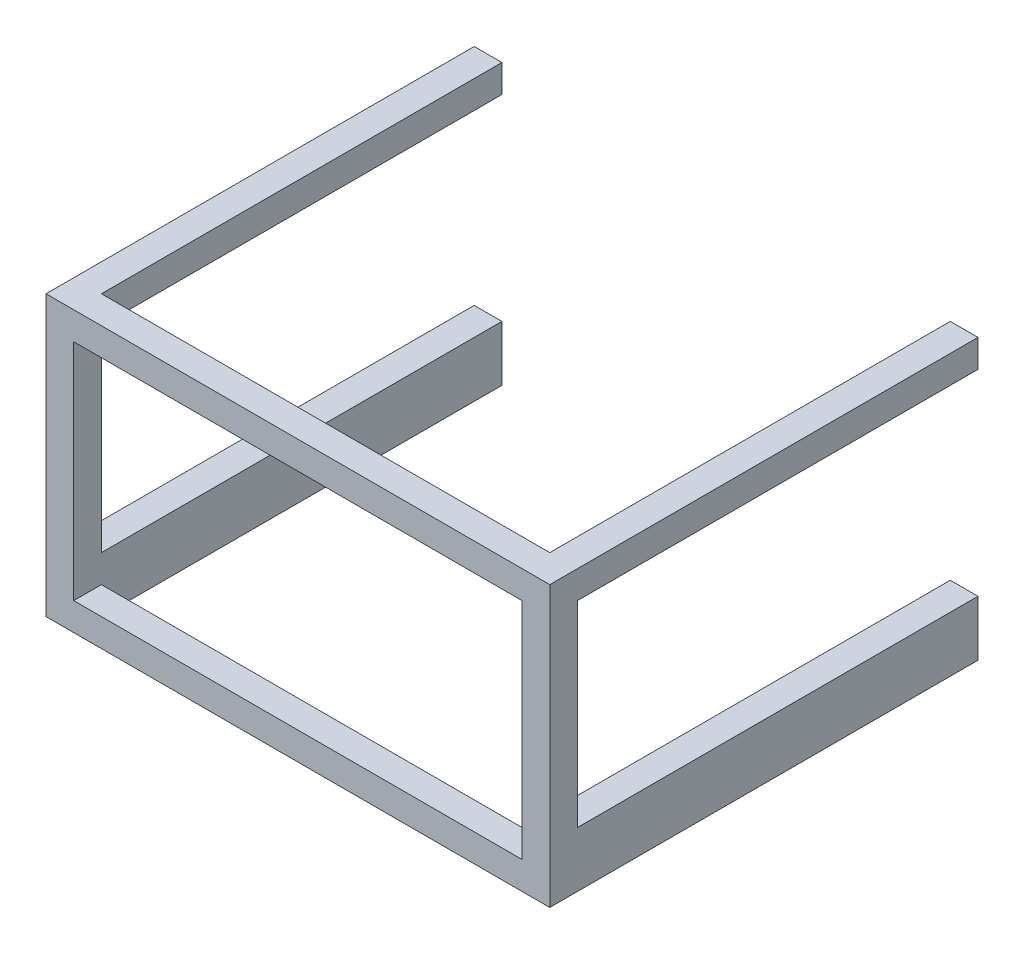
from build123d import *

# Parameters (mm, degrees)
ESQUISSE1_W             = 400
ESQUISSE1_H             = 222
BOSS_EXTRU_1_DEPTH      = 340
ESQUISSE2_W             = 356
ESQUISSE2_H             = 318
ENL_V_MAT_EXTRU_1_DEPTH = 462.790308903
ESQUISSE8_W             = 318
ESQUISSE8_H             = 156
ENL_V_MAT_EXTRU_2_DEPTH = 541.935999009
ESQUISSE9_W             = 356
ESQUISSE9_H             = 178
ENL_V_MAT_EXTRU_3_DEPTH = 426.41514362


with BuildPart() as part:
    # Esquisse1 → Boss.-Extru.1 (new body)
    with BuildSketch(Plane.XY):
        with Locations((19.923371648, -19.429118774)):
            Rectangle(ESQUISSE1_W, ESQUISSE1_H)
    extrude(amount=BOSS_EXTRU_1_DEPTH)

    # Esquisse2 → Enlèv. mat.-Extru.1 (cut, through all)
    with BuildSketch(Plane.XZ.offset(130.429118774)):
        with Locations((19.923371648, 159)):
            Rectangle(ESQUISSE2_W, ESQUISSE2_H)
    extrude(amount=-ENL_V_MAT_EXTRU_1_DEPTH, mode=Mode.SUBTRACT)

    # Esquisse8 → Enlèv. mat.-Extru.2 (cut, through all)
    with BuildSketch(Plane(origin=(219.923371648, 0, 0), x_dir=(0, 0, -1), z_dir=(1, 0, 0))):
        with Locations((-159, -8.429118774)):
            Rectangle(ESQUISSE8_W, ESQUISSE8_H)
    extrude(amount=-ENL_V_MAT_EXTRU_2_DEPTH, mode=Mode.SUBTRACT)

    # Esquisse9 → Enlèv. mat.-Extru.3 (cut, through all)
    with BuildSketch(Plane.XY.offset(340)):
        with Locations((19.923371648, -19.429118774)):
            Rectangle(ESQUISSE9_W, ESQUISSE9_H)
    extrude(amount=-ENL_V_MAT_EXTRU_3_DEPTH, mode=Mode.SUBTRACT)


solid = part.part
